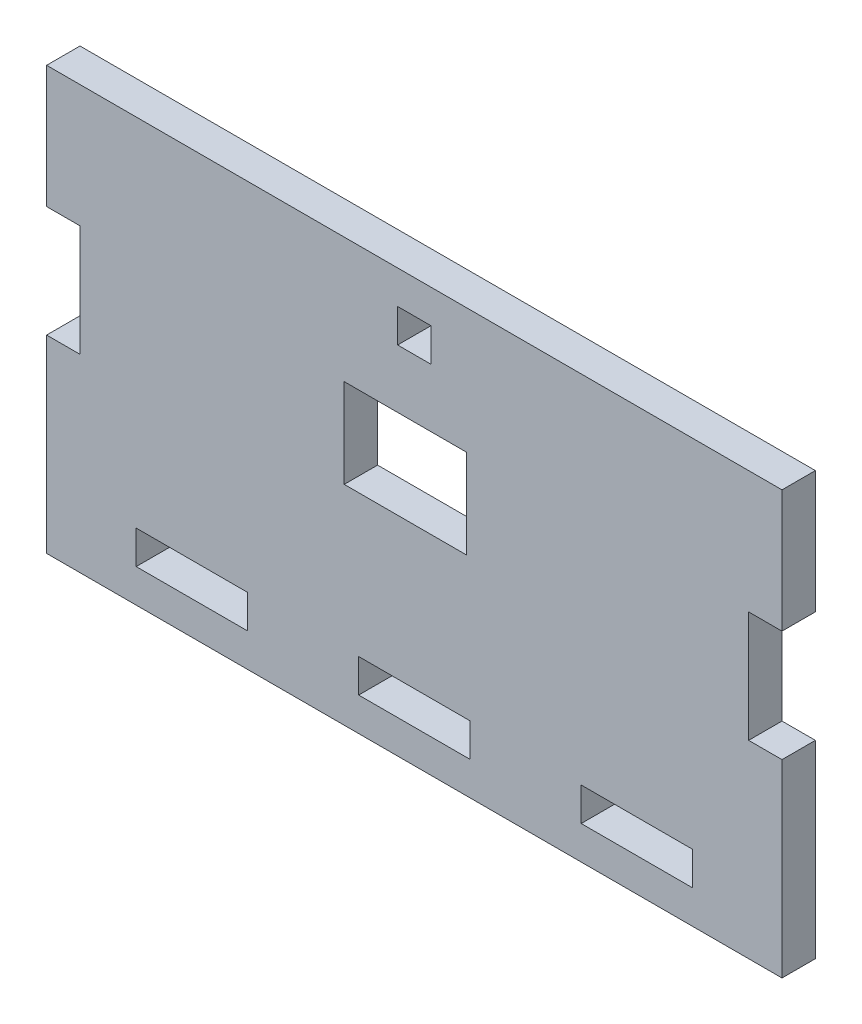
from build123d import *

# Parameters (mm, degrees)
SKETCH1_W           = 10
SKETCH1_H           = 3
SKETCH1_W_2         = 11
SKETCH1_H_2         = 8
SKETCH1_W_3         = 3
BOSS_EXTRUDE1_DEPTH = 3


with BuildPart() as part:
    # Sketch1 → Boss-Extrude1 (new body)
    with BuildSketch(Plane.XY):
        Polygon((4.993890114, 24.809336695), (-61.106109886, 24.809336695), (-61.106109886, 13.809336695), (-58.106109886, 13.809336695), (-58.106109886, 3.809336695), (-61.106109886, 3.809336695), (-61.106109886, -13.190663305), (4.993890114, -13.190663305), (4.993890114, 3.809336695), (1.993890114, 3.809336695), (1.993890114, 13.809336695), (4.993890114, 13.809336695), align=None)
        with Locations((-28.056109886, -8.690663305)):
            Rectangle(SKETCH1_W, SKETCH1_H, mode=Mode.SUBTRACT)
        with Locations((-28.856109886, 9.559336695)):
            Rectangle(SKETCH1_W_2, SKETCH1_H_2, mode=Mode.SUBTRACT)
        with Locations((-28.056109886, 20.309336695)):
            Rectangle(SKETCH1_W_3, SKETCH1_H, mode=Mode.SUBTRACT)
        with Locations((-8.056109886, -8.690663305)):
            Rectangle(SKETCH1_W, SKETCH1_H, mode=Mode.SUBTRACT)
        with Locations((-48.056109886, -8.690663305)):
            Rectangle(SKETCH1_W, SKETCH1_H, mode=Mode.SUBTRACT)
    extrude(amount=BOSS_EXTRUDE1_DEPTH)


solid = part.part
